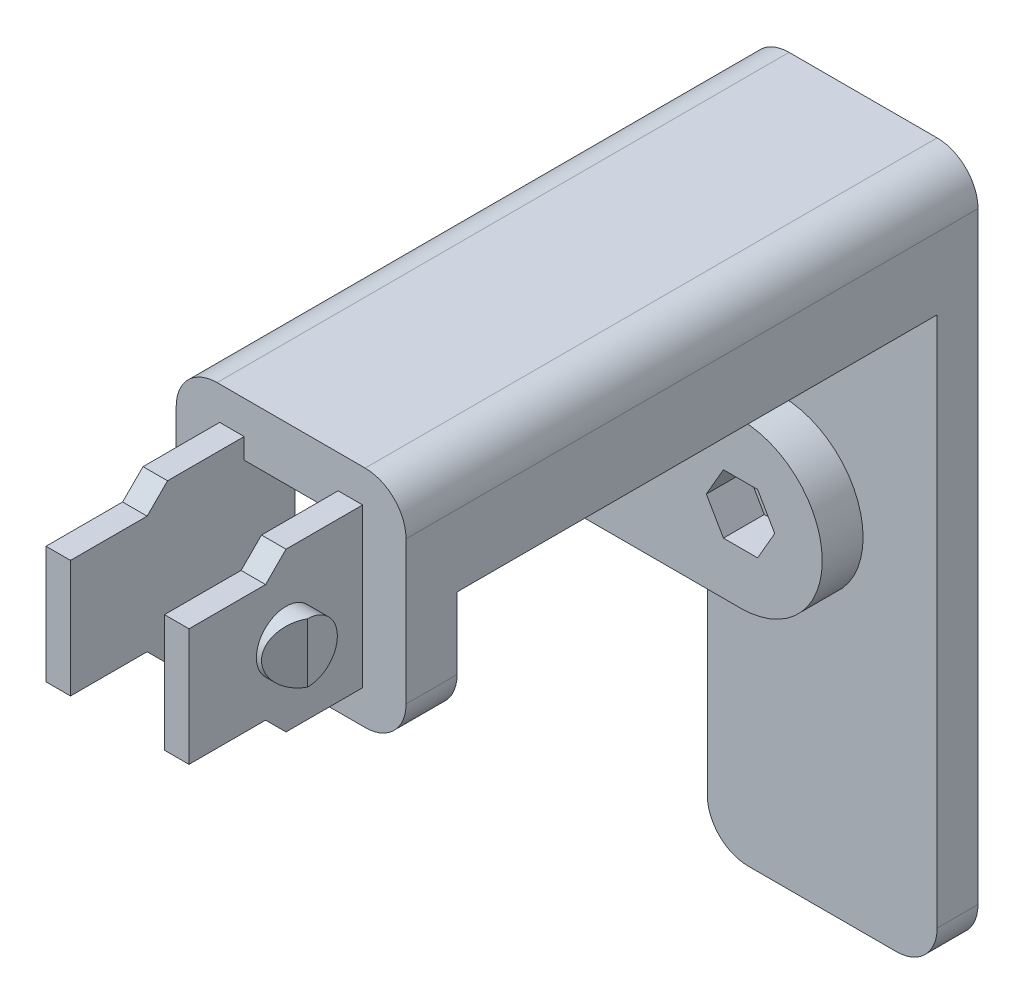
from build123d import *

# Parameters (mm, degrees)
SKETCH1_R           = 1.65
BOSS_EXTRUDE1_DEPTH = 75
CUT_EXTRUDE3_REACH  = 90.246
CUT_EXTRUDE4_REACH  = 85.882
SKETCH5_W           = 9.2
SKETCH5_H           = 11.5
SKETCH6_W           = 11.5
SKETCH6_H           = 11.5
CUT_EXTRUDE5_DEPTH  = 47
SKETCH7_W           = 30.25
SKETCH7_H           = 67
CUT_EXTRUDE6_DEPTH  = 2
CUT_EXTRUDE7_DEPTH  = 4
SKETCH9_W           = 17
SKETCH9_H           = 22
SKETCH9_R           = 2.9
CUT_EXTRUDE8_DEPTH  = 4.25
CUT_EXTRUDE9_START  = -4.25
SKETCH10_W          = 17
SKETCH10_H          = 22
SKETCH10_R          = 2.9
CUT_EXTRUDE9_DEPTH  = 4.25
CUT_EXTRUDE10_DEPTH = 17
CUT_EXTRUDE11_START = -18.25
CUT_EXTRUDE11_DEPTH = 14
CUT_EXTRUDE12_REACH = 103.995


with BuildPart() as part:
    # Sketch1 → Boss-Extrude1 (new body)
    with BuildSketch(Plane.XY):
        with BuildLine():
            Line((-17, -8), (-17, 8))
            Line((-17, 8), (-11.25, 8))
            ThreePointArc((-11.25, 8), (-8.421572875, 9.171572875), (-7.25, 12))
            Line((-7.25, 12), (-7.25, 29.5))
            ThreePointArc((-7.25, 29.5), (-6.078427125, 32.328427125), (-3.25, 33.5))
            Line((-3.25, 33.5), (11.25, 33.5))
            ThreePointArc((11.25, 33.5), (14.078427125, 32.328427125), (15.25, 29.5))
            Line((15.25, 29.5), (15.25, -29.5))
            ThreePointArc((15.25, -29.5), (14.078427125, -32.328427125), (11.25, -33.5))
            Line((11.25, -33.5), (-3.25, -33.5))
            ThreePointArc((-3.25, -33.5), (-6.078427125, -32.328427125), (-7.25, -29.5))
            Line((-7.25, -29.5), (-7.25, -12))
            ThreePointArc((-7.25, -12), (-8.421572875, -9.171572875), (-11.25, -8))
            Line((-11.25, -8), (-17, -8))
        make_face()
        Circle(SKETCH1_R, mode=Mode.SUBTRACT)
    extrude(amount=BOSS_EXTRUDE1_DEPTH)

    # Cut-Extrude3: up to this face of the body (flat: up to its plane)
    cut_extrude3_end = Plane(part.part.faces().sort_by_distance((-17, 0, 37.5))[0])
    # Sketch4 → Cut-Extrude3 (cut, up to the picked face)
    with BuildSketch(Plane(origin=(15.25, 0, 0), x_dir=(0, 0, -1), z_dir=(1, 0, 0)), mode=Mode.PRIVATE) as cut_extrude3_sk1:
        Polygon((-75, 11.5), (-75, -33.5), (-6, -33.5), (-6, -8), (-10, -8), (-10, 8), (-6, 8), (-6, 22.5), (-53, 22.5), (-53, 11.5), align=None)
    cut_extrude3_tool1 = split(extrude(cut_extrude3_sk1.sketch, amount=-CUT_EXTRUDE3_REACH, mode=Mode.PRIVATE), bisect_by=cut_extrude3_end, keep=Keep.BOTH, mode=Mode.PRIVATE)
    add(cut_extrude3_tool1.solids().sort_by(Axis((15.25, -7.129286, 39.486228), (-1, 0, 0)))[0], mode=Mode.SUBTRACT)

    # Cut-Extrude4: up to this face of the body (flat: up to its plane)
    cut_extrude4_end = Plane(part.part.faces().sort_by_distance((3.873526685, 15.183797252, 6))[0])
    # Sketch5 → Cut-Extrude4 (cut, up to the picked face)
    with BuildSketch(Plane.XY.offset(75), mode=Mode.PRIVATE) as cut_extrude4_sk1:
        with Locations((4, 22.5)):
            Rectangle(SKETCH5_W, SKETCH5_H)
    cut_extrude4_tool1 = split(extrude(cut_extrude4_sk1.sketch, amount=-CUT_EXTRUDE4_REACH, mode=Mode.PRIVATE), bisect_by=cut_extrude4_end, keep=Keep.BOTH, mode=Mode.PRIVATE)
    # Sketch5 → Cut-Extrude4 (cut, up to the picked face)
    with BuildSketch(Plane.XY.offset(75), mode=Mode.PRIVATE) as cut_extrude4_sk2:
        with BuildLine():
            Line((11.25, 11.5), (15.25, 11.5))
            Line((15.25, 11.5), (15.25, 15.5))
            ThreePointArc((15.25, 15.5), (14.078427125, 12.671572875), (11.25, 11.5))
        make_face()
    cut_extrude4_tool2 = split(extrude(cut_extrude4_sk2.sketch, amount=-CUT_EXTRUDE4_REACH, mode=Mode.PRIVATE), bisect_by=cut_extrude4_end, keep=Keep.BOTH, mode=Mode.PRIVATE)
    # Sketch5 → Cut-Extrude4 (cut, up to the picked face)
    with BuildSketch(Plane.XY.offset(75), mode=Mode.PRIVATE) as cut_extrude4_sk3:
        with BuildLine():
            Line((-7.281373033, 11.5), (-3.25, 11.5))
            ThreePointArc((-3.25, 11.5), (-6.078427125, 12.671572875), (-7.25, 15.5))
            Line((-7.25, 15.5), (-7.25, 12))
            ThreePointArc((-7.25, 12), (-7.257850963, 11.74950835), (-7.281373033, 11.5))
        make_face()
    cut_extrude4_tool3 = split(extrude(cut_extrude4_sk3.sketch, amount=-CUT_EXTRUDE4_REACH, mode=Mode.PRIVATE), bisect_by=cut_extrude4_end, keep=Keep.BOTH, mode=Mode.PRIVATE)
    # Sketch5 → Cut-Extrude4 (cut, up to the picked face)
    with BuildSketch(Plane.XY.offset(75), mode=Mode.PRIVATE) as cut_extrude4_sk4:
        with BuildLine():
            Line((0, 8), (15.25, 8))
            Line((15.25, 8), (15.25, -8))
            Line((15.25, -8), (0, -8))
            ThreePointArc((0, -8), (8, 0), (0, 8))
        make_face()
    cut_extrude4_tool4 = split(extrude(cut_extrude4_sk4.sketch, amount=-CUT_EXTRUDE4_REACH, mode=Mode.PRIVATE), bisect_by=cut_extrude4_end, keep=Keep.BOTH, mode=Mode.PRIVATE)
    add(cut_extrude4_tool1.solids().sort_by(Axis((4, 22.5, 75), (0, 0, -1)))[0], mode=Mode.SUBTRACT)
    add(cut_extrude4_tool2.solids().sort_by(Axis((14.356528, 12.393472, 75), (0, 0, -1)))[0], mode=Mode.SUBTRACT)
    add(cut_extrude4_tool3.solids().sort_by(Axis((-6.357899, 12.392305, 75), (0, 0, -1)))[0], mode=Mode.SUBTRACT)
    add(cut_extrude4_tool4.solids().sort_by(Axis((10.588812, 0, 75), (0, 0, -1)))[0], mode=Mode.SUBTRACT)

    # Sketch6 → Cut-Extrude5 (cut)
    with BuildSketch(Plane.XY.offset(6)):
        with Locations((4, 22.5)):
            Rectangle(SKETCH6_W, SKETCH6_H)
    extrude(amount=CUT_EXTRUDE5_DEPTH, mode=Mode.SUBTRACT)

    # Sketch7 → Cut-Extrude6 (cut)
    with BuildSketch(Plane(origin=(0, 0, 0), x_dir=(-1, 0, 0), z_dir=(0, 0, -1))):
        with Locations((-0.125, 0)):
            Rectangle(SKETCH7_W, SKETCH7_H)
    extrude(amount=-CUT_EXTRUDE6_DEPTH, mode=Mode.SUBTRACT)

    # Sketch8 → Cut-Extrude7 (cut)
    with BuildSketch(Plane.XY.offset(10)):
        Polygon((3.348631561, 0), (1.674315781, 2.9), (-1.674315781, 2.9), (-3.348631561, 0), (-1.674315781, -2.9), (1.674315781, -2.9), align=None)
    extrude(amount=-CUT_EXTRUDE7_DEPTH, mode=Mode.SUBTRACT)

    # Sketch9 → Cut-Extrude8 (cut)
    with BuildSketch(Plane(origin=(15.25, 0, 0), x_dir=(0, 0, -1), z_dir=(1, 0, 0))):
        with Locations((-66.5, 22.5)):
            Rectangle(SKETCH9_W, SKETCH9_H)
        with Locations(Location((-65.5, 22.5, 0), (0, 0, 90))):
            Circle(SKETCH9_R, mode=Mode.SUBTRACT)
    extrude(amount=-CUT_EXTRUDE8_DEPTH, mode=Mode.SUBTRACT)

    # Sketch10 → Cut-Extrude9 (cut)
    with BuildSketch(Plane.ZY.offset(7.25).offset(CUT_EXTRUDE9_START)):
        with Locations((66.5, 22.5)):
            Rectangle(SKETCH10_W, SKETCH10_H)
        with Locations(Location((65.5, 22.5, 0), (0, 0, 90))):
            Circle(SKETCH10_R, mode=Mode.SUBTRACT)
    extrude(amount=CUT_EXTRUDE9_DEPTH, mode=Mode.SUBTRACT)

    # Sketch11 → Cut-Extrude10 (cut)
    with BuildSketch(Plane.XY.offset(75)):
        Polygon((-7.25, 14.75), (-7.25, 11.5), (15.25, 11.5), (15.25, 14.75), (8.6, 14.75), (8.6, 30.25), (15.25, 30.25), (15.25, 33.5), (-7.25, 33.5), (-7.25, 30.25), (-0.6, 30.25), (-0.6, 14.75), align=None)
    extrude(amount=-CUT_EXTRUDE10_DEPTH, mode=Mode.SUBTRACT)

    # Sketch12 → Cut-Extrude11 (cut)
    with BuildSketch(Plane.ZY.offset(7.25).offset(CUT_EXTRUDE11_START)):
        Polygon((65.5, 30.25), (67.5, 28.25), (75, 28.25), (75, 30.25), align=None)
        Polygon((65.5, 14.75), (67.5, 16.75), (75, 16.75), (75, 14.75), align=None)
    extrude(amount=CUT_EXTRUDE11_DEPTH, mode=Mode.SUBTRACT)

    # Cut-Extrude12: up to this face of the body (flat: up to its plane)
    cut_extrude12_end = Plane(part.part.faces().sort_by_distance((4, 11.5, 55.5))[0])
    # Sketch13 → Cut-Extrude12 (cut, up to the picked face)
    with BuildSketch(Plane(origin=(0, 33.5, 0), x_dir=(1, 0, 0), z_dir=(0, 1, 0)), mode=Mode.PRIVATE) as cut_extrude12_sk1:
        Polygon((-5.1, -65.5), (-3.5, -68.4), (-7.25, -68.4), (-7.25, -62.6), (-5.125, -62.6), align=None)
    cut_extrude12_tool1 = split(extrude(cut_extrude12_sk1.sketch, amount=-CUT_EXTRUDE12_REACH, mode=Mode.PRIVATE), bisect_by=cut_extrude12_end, keep=Keep.BOTH, mode=Mode.PRIVATE)
    # Sketch13 → Cut-Extrude12 (cut, up to the picked face)
    with BuildSketch(Plane(origin=(0, 33.5, 0), x_dir=(1, 0, 0), z_dir=(0, 1, 0)), mode=Mode.PRIVATE) as cut_extrude12_sk2:
        Polygon((13.1, -65.5), (11.5, -68.4), (15.25, -68.4), (15.25, -62.6), (13.125, -62.6), align=None)
    cut_extrude12_tool2 = split(extrude(cut_extrude12_sk2.sketch, amount=-CUT_EXTRUDE12_REACH, mode=Mode.PRIVATE), bisect_by=cut_extrude12_end, keep=Keep.BOTH, mode=Mode.PRIVATE)
    add(cut_extrude12_tool1.solids().sort_by(Axis((-5.924713, 33.5, 65.808763), (0, -1, 0)))[0], mode=Mode.SUBTRACT)
    add(cut_extrude12_tool2.solids().sort_by(Axis((13.924713, 33.5, 65.808763), (0, -1, 0)))[0], mode=Mode.SUBTRACT)


solid = part.part
